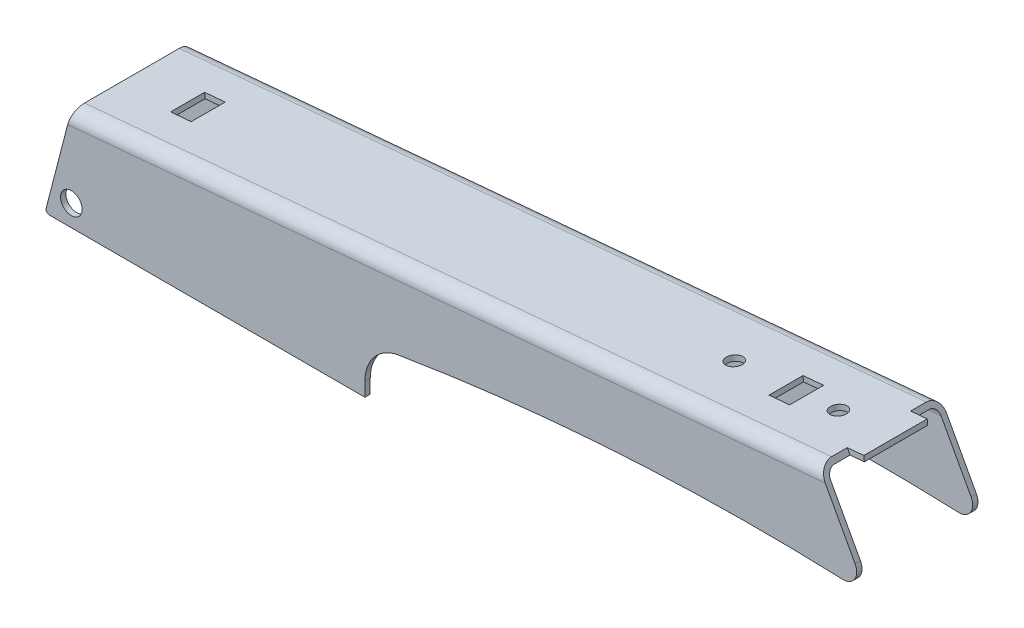
from build123d import *

# Parameters (mm, degrees)
BOSS_EXTRUDE1_DEPTH = 11.557
FILLET1_R           = 2.54
FILLET2_R           = 0.635
SHELL1_T            = -1.016
SKETCH3_W           = 12.065
SKETCH3_H           = 1.016
BOSS_EXTRUDE2_DEPTH = 3.175
SKETCH4_R           = 1.524
SKETCH4_W           = 3.937
SKETCH4_H           = 6.477
CUT_EXTRUDE1_DEPTH  = 158.908914941
SKETCH5_R           = 2.0574
CUT_EXTRUDE2_DEPTH  = 160.727285329


with BuildPart() as part:
    # Sketch1 → Boss-Extrude1 (new, symmetric)
    with BuildSketch(Plane.XY):
        with BuildLine():
            Line((0, 0), (60.96, 0))
            Line((60.96, 0), (60.96, 2.641614405))
            ThreePointArc((60.96, 2.641614405), (62.769867337, 7.571802884), (67.339726625, 10.16))
            ThreePointArc((67.339726625, 10.16), (109.560204459, 14.953353711), (152.048769719, 15.469890784))
            ThreePointArc((152.048769719, 15.469890784), (154.303696185, 16.667899597), (154.378077788, 19.220229093))
            Line((154.378077788, 19.220229093), (147.366478068, 32.131))
            Line((147.366478068, 32.131), (4.991923978, 19.304))
            Line((4.991923978, 19.304), (0, 0))
        make_face()
    extrude(amount=BOSS_EXTRUDE1_DEPTH, both=True)

    # Fillet1
    fillet1_edges = [part.edges().sort_by_distance(p)[0] for p in [
        (76.179201023, 25.7175, -11.557),
        (76.179201023, 25.7175, 11.557),
    ]]
    fillet(fillet1_edges, radius=FILLET1_R)

    # Fillet2
    fillet2_edges = [part.edges().sort_by_distance(p)[0] for p in [
        (0, 0, 0),
    ]]
    fillet(fillet2_edges, radius=FILLET2_R)

    # Shell1
    shell1_openings = [part.faces().sort_by_distance(p)[0] for p in [
        (150.901052558, 25.62263054, 0),
        (154.303696185, 16.667899597, 0),
        (109.560204459, 14.953353711, 0),
        (60.96, 1.320807203, 0),
        (62.769867337, 7.571802884, 0),
        (30.890048092, 0, 0),
        (0.318012361, 0.246236787, 0),
        (2.583601555, 9.990906242, 0),
    ]]
    offset(amount=SHELL1_T, openings=shell1_openings, kind=Kind.INTERSECTION)

    # Sketch3 → Boss-Extrude2 (add)
    with BuildSketch(Plane(origin=(149.051444963, 13.428543441, 0), x_dir=(0, 0, -1), z_dir=(0.9959661345298199, 0.08972992181947408, 0))):
        with Locations((0, 18.270205313)):
            Rectangle(SKETCH3_W, SKETCH3_H)
    extrude(amount=BOSS_EXTRUDE2_DEPTH)

    # Sketch4 → Cut-Extrude1 (cut, through all)
    with BuildSketch(Plane(origin=(-1.684966895, 18.702456559, 0), x_dir=(0.9959661345298199, 0.08972992181947409, 0), z_dir=(-0.08972992181947409, 0.9959661345298199, 0))):
        with Locations((121.969133639, 0)):
            Circle(SKETCH4_R)
        with Locations((141.908133639, 0)):
            Circle(SKETCH4_R)
        with Locations((19.340433639, 0)):
            Rectangle(SKETCH4_W, SKETCH4_H)
        with Locations((133.843633639, 0)):
            Rectangle(SKETCH4_W, SKETCH4_H)
    extrude(amount=-CUT_EXTRUDE1_DEPTH, mode=Mode.SUBTRACT)

    # Sketch5 → Cut-Extrude2 (cut, through all)
    with BuildSketch(Plane.XY.offset(11.557)):
        with Locations((5.012495837, 4.064)):
            Circle(SKETCH5_R)
    extrude(amount=-CUT_EXTRUDE2_DEPTH, mode=Mode.SUBTRACT)


solid = part.part
